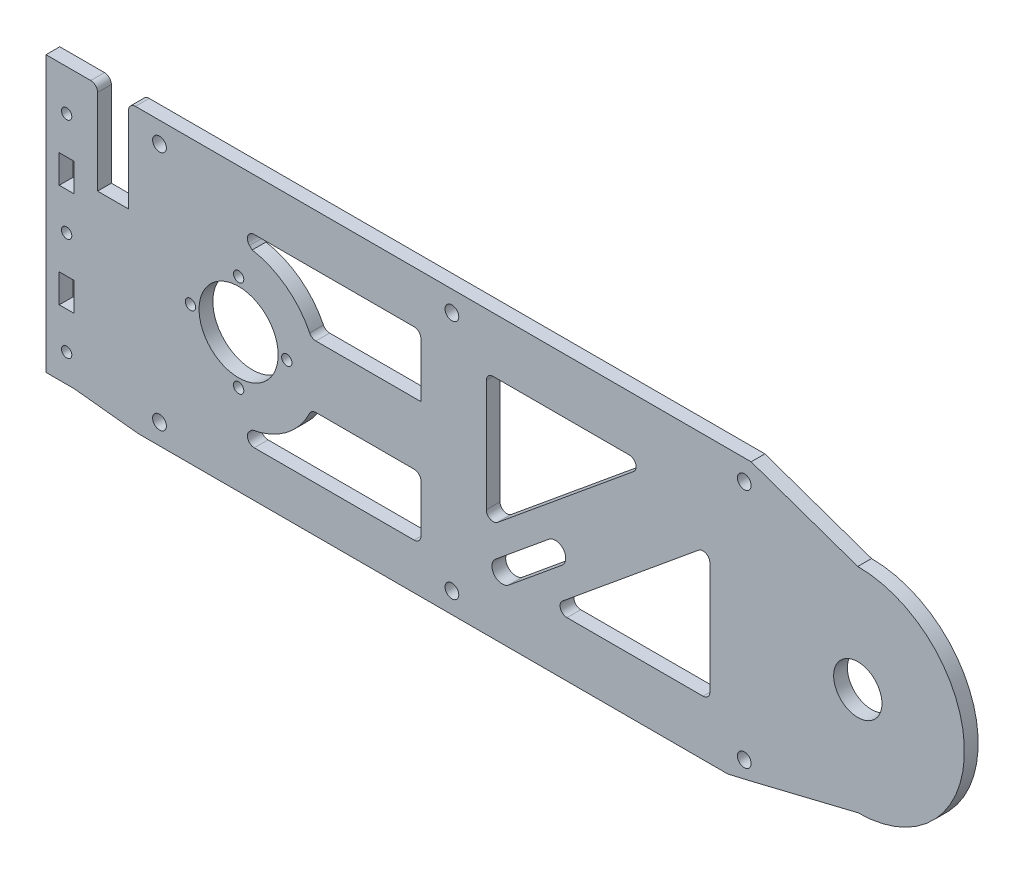
from build123d import *

# Parameters (mm, degrees)
SKETCH_1_R          = 1.5
SKETCH_1_R_2        = 11.5
SKETCH_1_R_3        = 7.02
SKETCH_1_W          = 4.3
SKETCH_1_H          = 8.2
SKETCH_1_H_2        = 8.3
EXTRUDE_1_DEPTH     = 4
SKETCH_2_R          = 2
CUT_EXTRUDE_1_DEPTH = 4
FILLET_1_R          = 2


with BuildPart() as part:
    # 草图1 → 凸台-拉伸1 (new body)
    with BuildSketch(Plane.XY):
        with BuildLine():
            Line((-5.457142857, -0.095714286), (-5.457142857, 41.754285714))
            Line((-5.457142857, 41.754285714), (9.542857143, 41.754285714))
            Line((9.542857143, 41.754285714), (9.542857143, 14.904285714))
            Line((9.542857143, 14.904285714), (18.542857143, 14.904285714))
            Line((18.542857143, 14.904285714), (18.542857143, 41.754285714))
            Line((18.542857143, 41.754285714), (199.542857143, 41.754285714))
            Line((199.542857143, 41.754285714), (230.542857143, 30.904285714))
            ThreePointArc((230.542857143, 30.904285714), (261.542857143, -0.095714286), (230.542857143, -31.095714286))
            Line((230.542857143, -31.095714286), (199.556073527, -38.65591431))
            Line((199.556073527, -38.65591431), (192.746868021, -40.245714286))
            Line((192.746868021, -40.245714286), (21.365844759, -40.245714286))
            Line((21.365844759, -40.245714286), (2.692857143, -38.245714286))
            Line((2.692857143, -38.245714286), (-5.457142857, -38.245714286))
            Line((-5.457142857, -38.245714286), (-5.457142857, -0.095714286))
        make_face()
        with Locations((0.542857143, 29.904285714)):
            Circle(SKETCH_1_R, mode=Mode.SUBTRACT)
        with Locations((0.542857143, -0.095714286)):
            Circle(SKETCH_1_R, mode=Mode.SUBTRACT)
        with Locations((0.542857143, -30.095714286)):
            Circle(SKETCH_1_R, mode=Mode.SUBTRACT)
        with Locations((50.542857143, -0.095714286)):
            Circle(SKETCH_1_R_2, mode=Mode.SUBTRACT)
        with Locations((50.542857143, -14.095714286)):
            Circle(SKETCH_1_R, mode=Mode.SUBTRACT)
        with Locations((36.542857143, -0.095714286)):
            Circle(SKETCH_1_R, mode=Mode.SUBTRACT)
        with Locations((50.542857143, 13.904285714)):
            Circle(SKETCH_1_R, mode=Mode.SUBTRACT)
        with Locations((64.542857143, -0.095714286)):
            Circle(SKETCH_1_R, mode=Mode.SUBTRACT)
        with Locations((230.542857143, -0.095714286)):
            Circle(SKETCH_1_R_3, mode=Mode.SUBTRACT)
        with Locations((0.542857143, 14.904285714)):
            Rectangle(SKETCH_1_W, SKETCH_1_H, mode=Mode.SUBTRACT)
        with Locations((0.542857143, -15.145714286)):
            Rectangle(SKETCH_1_W, SKETCH_1_H_2, mode=Mode.SUBTRACT)
    extrude(amount=EXTRUDE_1_DEPTH)

    # 草图2 → 切除-拉伸1 (cut)
    with BuildSketch(Plane.XY.offset(4)):
        with Locations((27.542857143, 35.754285714)):
            Circle(SKETCH_2_R)
        with Locations((112.542857143, 35.754285714)):
            Circle(SKETCH_2_R)
        with Locations((197.542857143, 35.754285714)):
            Circle(SKETCH_2_R)
        with Locations((112.542857143, -34.245714286)):
            Circle(SKETCH_2_R)
        with Locations((197.542857143, -34.245714286)):
            Circle(SKETCH_2_R)
        with Locations((27.542857143, -34.245714286)):
            Circle(SKETCH_2_R)
        Polygon((187.542857143, -24.245714286), (140.41622539, -24.245714286), (187.542857143, 14.56445304), align=None)
        Polygon((122.542857143, 25.754285714), (169.669488896, 25.754285714), (122.542857143, -13.055881612), align=None)
        with BuildLine():
            Line((71.708867631, 8.904285714), (103.542857143, 8.904285714))
            Line((103.542857143, 8.904285714), (103.542857143, 26.754285714))
            Line((103.542857143, 26.754285714), (50.083702197, 26.754285714))
            Line((50.083702197, 26.754285714), (54.496758946, 22.561881803))
            ThreePointArc((54.496758946, 22.561881803), (64.839184682, 17.921361473), (71.708867631, 8.904285714))
        make_face()
        with BuildLine():
            Line((103.542857143, -9.095714286), (103.542857143, -26.945714286))
            Line((103.542857143, -26.945714286), (50.083702197, -26.945714286))
            Line((50.083702197, -26.945714286), (54.496758946, -22.753310375))
            ThreePointArc((54.496758946, -22.753310375), (64.839184682, -18.112790044), (71.708867631, -9.095714286))
            Line((71.708867631, -9.095714286), (103.542857143, -9.095714286))
        make_face()
        with BuildLine():
            Line((125.279005787, -19.870759717), (140.7176105, -7.15661466))
            ThreePointArc((140.7176105, -7.15661466), (144.940522965, -7.565283608), (144.531854017, -11.788196074))
            Line((144.531854017, -11.788196074), (129.093249305, -24.502341131))
            ThreePointArc((129.093249305, -24.502341131), (124.870336839, -24.093672183), (125.279005787, -19.870759717))
        make_face()
    extrude(amount=-CUT_EXTRUDE_1_DEPTH, mode=Mode.SUBTRACT)

    # 圆角1
    fillet_1_edges = [part.edges().sort_by_distance(p)[0] for p in [
        (71.708867631, 8.904285714, 2),
        (50.083702197, 26.754285714, 2),
        (103.542857143, 26.754285714, 2),
        (122.542857143, -13.055881612, 2),
        (122.542857143, 25.754285714, 2),
        (169.669488896, 25.754285714, 2),
        (187.542857143, 14.56445304, 2),
        (187.542857143, -24.245714286, 2),
        (140.41622539, -24.245714286, 2),
        (103.542857143, -26.945714286, 2),
        (50.083702197, -26.945714286, 2),
        (71.708867631, -9.095714286, 2),
        (103.542857143, -9.095714286, 2),
        (9.542857143, 41.754285714, 2),
        (18.542857143, 41.754285714, 2),
    ]]
    fillet(fillet_1_edges, radius=FILLET_1_R)


solid = part.part
